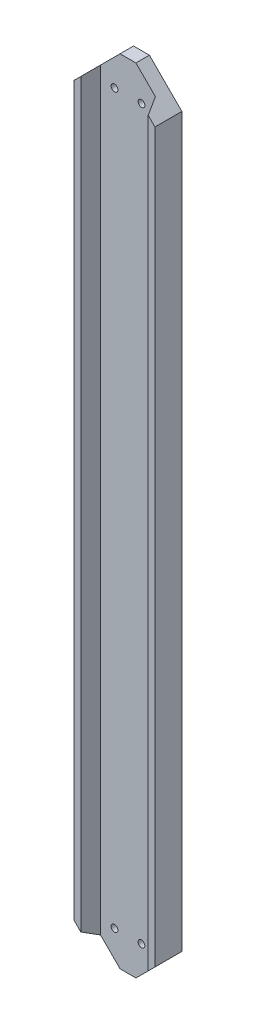
from build123d import *

# Parameters (mm, degrees)
EXTRUDE_1_DEPTH     = 10
SKETCH_2_W          = 30
SKETCH_2_H          = 10
EXTRUDE_2_DEPTH     = 267.5
SKETCH_3_W          = 25
SKETCH_3_H          = 309.1
CUT_EXTRUDE_1_DEPTH = 5
CUT_EXTRUDE_1_DRAFT = -25
CUT_EXTRUDE_2_DEPTH = 296.795216324
SKETCH_5_R          = 1.25
CUT_EXTRUDE_3_DEPTH = 10
SKETCH_6_W          = 20.368461709
SKETCH_6_H          = 6.660502167
CUT_EXTRUDE_4_DEPTH = 400


with BuildPart() as part:
    # 스케치1 → 보스-돌출1 (new body)
    with BuildSketch(Plane.XY):
        Polygon((0, 0), (-30, 0), (-30, 2.5), (-17.95, 14.55), (-12.05, 14.55), (0, 2.5), align=None)
    extrude_1 = extrude(amount=EXTRUDE_1_DEPTH)

    # 스케치2 → 보스-돌출2 (add)
    with BuildSketch(Plane.XZ):
        with Locations((-15, 5)):
            Rectangle(SKETCH_2_W, SKETCH_2_H)
    extrude(amount=EXTRUDE_2_DEPTH)

    # 대칭 복사1: 보스-돌출1 across plane
    add(extrude_1.mirror(Plane(origin=(0, -132.5, 0), x_dir=(0, 0, 1), z_dir=(0, -1, 0))))


with BuildPart() as cut_extrude_1_tool:
    # 스케치3 → 컷-돌출1 (with draft: the straight prism first)
    with BuildSketch(Plane.XY.offset(10)):
        with Locations((-15, -140)):
            Rectangle(SKETCH_3_W, SKETCH_3_H)
    extrude(amount=-CUT_EXTRUDE_1_DEPTH)
    # 컷-돌출1: the draft: its side faces are tilted about the plane it starts from
    cut_extrude_1_sides = [cut_extrude_1_tool.faces().sort_by_distance(p)[0] for p in [
        (-27.5, -140, 7.5),
        (-15, -294.55, 7.5),
        (-2.5, -140, 7.5),
        (-15, 14.55, 7.5),
    ]]
    draft(cut_extrude_1_sides, Plane.XY.offset(10), CUT_EXTRUDE_1_DRAFT)


with BuildPart() as part_1:
    add(part.part)

    # 컷-돌출1: cut by cut_extrude_1_tool
    add(cut_extrude_1_tool.part, mode=Mode.SUBTRACT)

    # 스케치4 → 컷-돌출2 (cut, through all)
    with BuildSketch(Plane.XZ.offset(279.55)):
        Polygon((-27.5, 10), (-2.5, 10), (-14.35, 5), (-25.2, 5), align=None)
    extrude(amount=-CUT_EXTRUDE_2_DEPTH, mode=Mode.SUBTRACT)

    # 스케치5 → 컷-돌출3 (cut)
    with BuildSketch(Plane.XY.offset(10)):
        with Locations((-10, 2.55)):
            Circle(SKETCH_5_R)
        with Locations((-20, 2.55)):
            Circle(SKETCH_5_R)
    cut_extrude_3 = extrude(amount=-CUT_EXTRUDE_3_DEPTH, mode=Mode.SUBTRACT)

    # 대칭 복사2: 컷-돌출3 across plane
    add(cut_extrude_3.mirror(Plane(origin=(0, -132.5, 0), x_dir=(0, 0, 1), z_dir=(0, -1, 0))), mode=Mode.SUBTRACT)

    # 스케치6 → 컷-돌출4 (cut)
    with BuildSketch(Plane.XZ.offset(279.55)):
        with Locations((-15.015769146, 8.330251084)):
            Rectangle(SKETCH_6_W, SKETCH_6_H)
    extrude(amount=-CUT_EXTRUDE_4_DEPTH, mode=Mode.SUBTRACT)


solid = part_1.part
